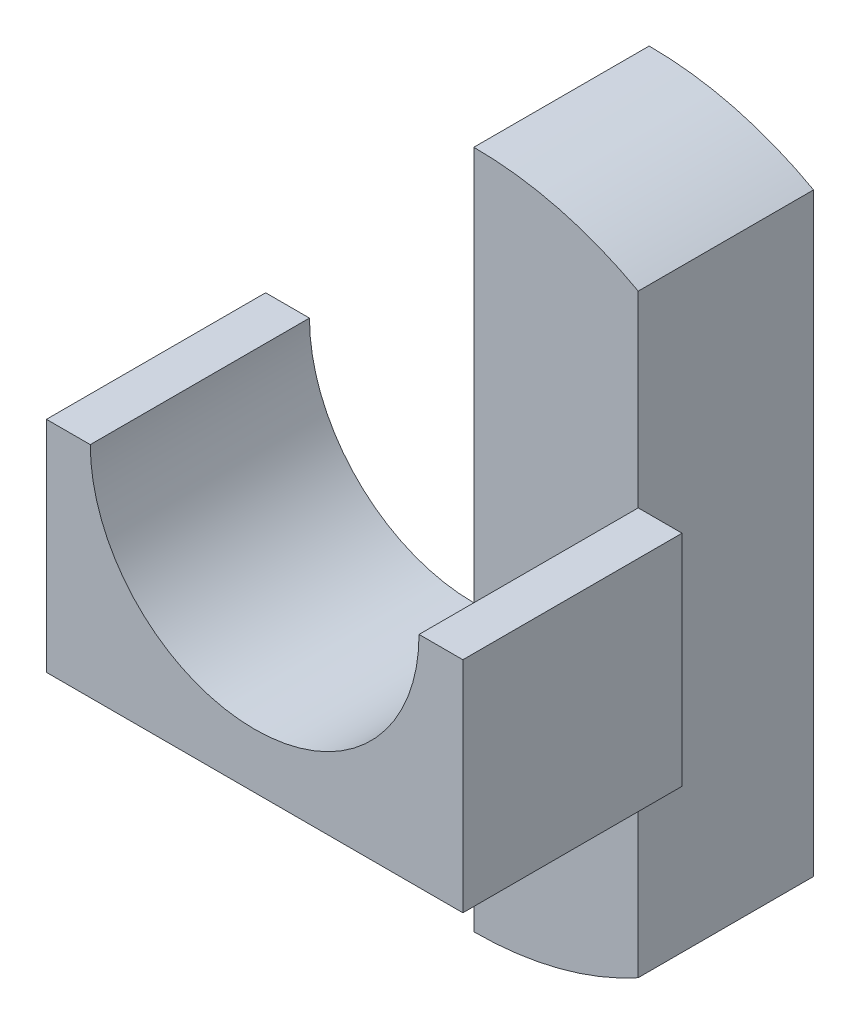
from build123d import *

# Parameters (mm, degrees)
EXTRUDE_1_DEPTH = 8
EXTRUDE_2_DEPTH = 10


with BuildPart() as part:
    # 草图1 → 凸台-拉伸1 (new body)
    with BuildSketch(Plane.XY):
        with BuildLine():
            Line((7.5, -13.564659966), (7.5, 13.564659966))
            ThreePointArc((7.5, 13.564659966), (3.872839431, 15.008368157), (0, 15.5))
            Line((0, 15.5), (0, -15.5))
            ThreePointArc((0, -15.5), (3.872839431, -15.008368157), (7.5, -13.564659966))
        make_face()
    extrude(amount=EXTRUDE_1_DEPTH)

    # 草图3 → 凸台-拉伸2 (add)
    with BuildSketch(Plane.XY.offset(8)):
        Polygon((7.5, -2.5), (7.5, -5), (9.5, -5), (9.5, 5), (7.5, 5), align=None)
        with BuildLine():
            Line((0, -2.5), (0, -5))
            Line((0, -5), (7.5, -5))
            Line((7.5, -5), (7.5, -2.5))
            Line((7.5, -2.5), (7.5, 5))
            ThreePointArc((7.5, 5), (5.303300859, -0.303300859), (0, -2.5))
        make_face()
        with BuildLine():
            Line((-7.5, 5), (-7.5, -2.5))
            Line((-7.5, -2.5), (-7.5, -5))
            Line((-7.5, -5), (0, -5))
            Line((0, -5), (0, -2.5))
            ThreePointArc((0, -2.5), (-5.303300859, -0.303300859), (-7.5, 5))
        make_face()
        Polygon((-9.5, 5), (-7.5, 5), (-7.5, -2.5), (-7.5, -5), (-9.5, -5), align=None)
    extrude(amount=EXTRUDE_2_DEPTH)


solid = part.part
